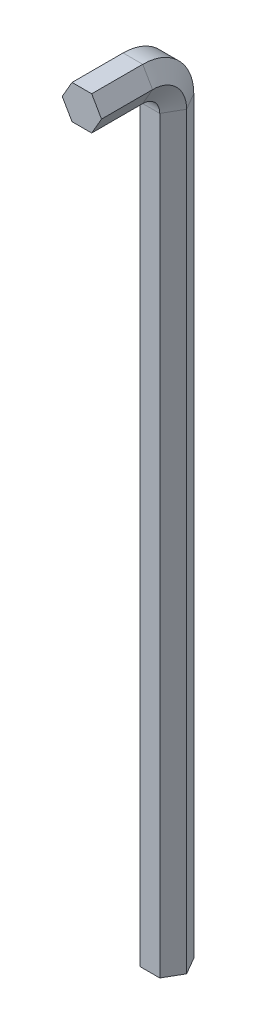
from build123d import *

# Parameters (mm, degrees)
BOSS_EXTRUDE1_DEPTH = 220
REVOLVE1_ANGLE      = 90
BOSS_EXTRUDE2_DEPTH = 15


with BuildPart() as part:
    # Sketch1 → Boss-Extrude1 (new body)
    with BuildSketch(Plane(origin=(0, 0, 0), x_dir=(1, 0, 0), z_dir=(0, 1, 0))):
        Polygon((5.773502692, 0), (2.886751346, 5), (-2.886751346, 5), (-5.773502692, 0), (-2.886751346, -5), (2.886751346, -5), align=None)
    extrude(amount=BOSS_EXTRUDE1_DEPTH)

    # Sketch2 → Revolve1 (revolve)
    with BuildSketch(Plane(origin=(0, 220, 0), x_dir=(1, 0, 0), z_dir=(0, 1, 0))):
        Polygon((-2.886751346, -5), (2.886751346, -5), (5.773502692, 0), (2.886751346, 5), (-2.886751346, 5), (-5.773502692, 0), align=None)
    revolve(axis=Axis((-6.610252502, 220, 10), (1, 0, 0)), revolution_arc=REVOLVE1_ANGLE)

    # Sketch3 → Boss-Extrude2 (add)
    with BuildSketch(Plane.XY.offset(10)):
        Polygon((-5.773502692, 230), (-2.886751346, 225), (2.886751346, 225), (5.773502692, 230), (2.886751346, 235), (-2.886751346, 235), align=None)
    extrude(amount=BOSS_EXTRUDE2_DEPTH)


solid = part.part
